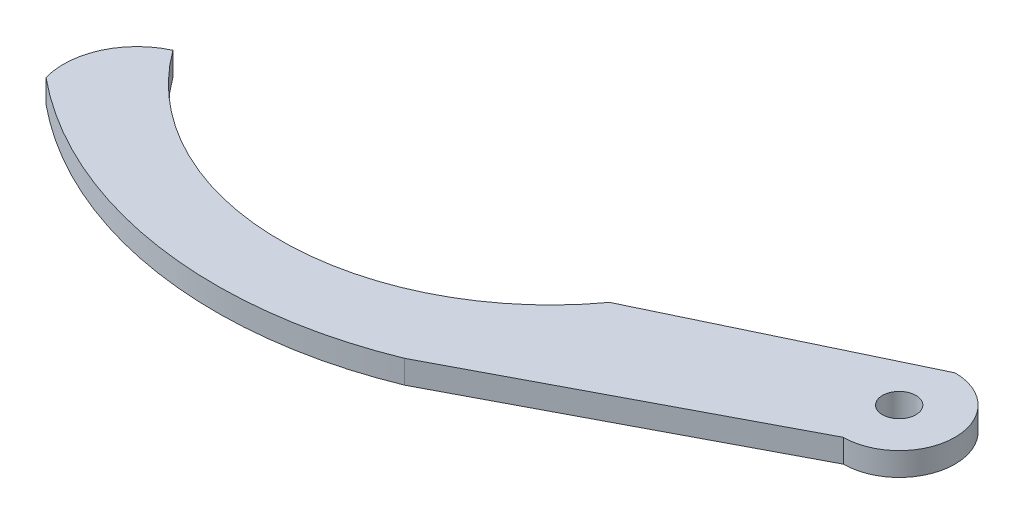
from build123d import *

# Parameters (mm, degrees)
SKETCH1_R           = 2.286
BOSS_EXTRUDE1_DEPTH = 3.175


with BuildPart() as part:
    # Sketch1 → Boss-Extrude1 (new body)
    with BuildSketch(Plane(origin=(0, 0, 0), x_dir=(1, 0, 0), z_dir=(0, 1, 0))):
        with BuildLine():
            Line((-31.898482314, -7.62), (0, 7.62))
            ThreePointArc((0, 7.62), (7.62, 0), (0, -7.62))
            Line((0, -7.62), (-39.266643524, -28.218839839))
            ThreePointArc((-39.266643524, -28.218839839), (-69.304091982, -31.809710463), (-96.940525037, -19.506449524))
            ThreePointArc((-96.940525037, -19.506449524), (-96.41727765, -12.558332827), (-91.501691991, -7.62))
            ThreePointArc((-91.501691991, -7.62), (-61.700087152, -22.761590746), (-31.898482314, -7.62))
        make_face()
        with Locations(Location((0, 0, 0), (0, 0, 270))):
            Circle(SKETCH1_R, mode=Mode.SUBTRACT)
    extrude(amount=BOSS_EXTRUDE1_DEPTH)


solid = part.part
